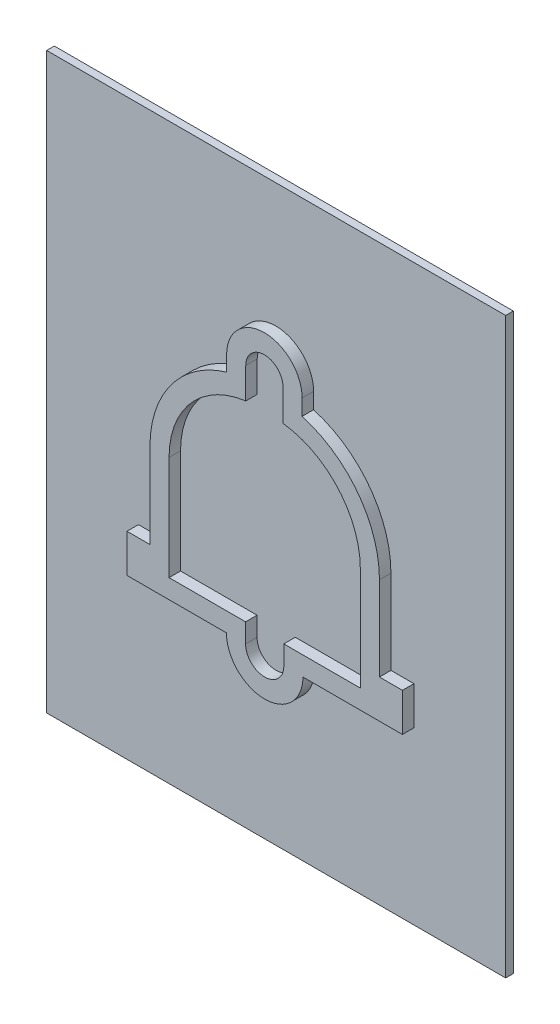
from build123d import *

# Parameters (mm, degrees)
EXTRUSION3_DEPTH = 0.3
ESQUISSE2_W      = 12
ESQUISSE2_H      = 15
EXTRUSION4_DEPTH = 0.2


with BuildPart() as part:
    # Esquisse1 → Extrusion3 (new body)
    with BuildSketch(Plane.XY):
        with BuildLine():
            Line((-12.832841813, 25.021420219), (-12.832841813, 25.437540043))
            ThreePointArc((-12.832841813, 25.437540043), (-13.819409399, 26.424107629), (-14.805976985, 25.437540043))
            Line((-14.805976985, 25.437540043), (-14.805976985, 25.037540043))
            ThreePointArc((-14.805976985, 25.037540043), (-15.667751578, 24.60975507), (-16.333846188, 23.915512028))
            ThreePointArc((-16.333846188, 23.915512028), (-16.688617291, 23.169755053), (-16.810405862, 22.352942012))
            Line((-16.810405862, 22.352942012), (-16.810405862, 20.131551422))
            Line((-16.810405862, 20.131551422), (-17.410405862, 20.131551422))
            Line((-17.410405862, 20.131551422), (-17.410405862, 19.131551422))
            Line((-17.410405862, 19.131551422), (-14.810405862, 19.131551422))
            ThreePointArc((-14.810405862, 19.131551422), (-13.810405862, 18.131551422), (-12.810405862, 19.131551422))
            Line((-12.810405862, 19.131551422), (-10.210405862, 19.131551422))
            Line((-10.210405862, 19.131551422), (-10.210405862, 20.131551422))
            Line((-10.210405862, 20.131551422), (-10.810405862, 20.131551422))
            Line((-10.810405862, 20.131551422), (-10.810405862, 22.331551422))
            ThreePointArc((-10.810405862, 22.331551422), (-11.372418001, 24.014230931), (-12.832841813, 25.021420219))
        make_face()
        with BuildLine():
            Line((-11.310405862, 22.331551422), (-11.310405862, 19.631551422))
            Line((-11.310405862, 19.631551422), (-13.310405862, 19.631551422))
            Line((-13.310405862, 19.631551422), (-13.310405862, 19.131551422))
            ThreePointArc((-13.310405862, 19.131551422), (-13.810405862, 18.631551422), (-14.310405862, 19.131551422))
            Line((-14.310405862, 19.131551422), (-14.310405862, 19.631551422))
            Line((-14.310405862, 19.631551422), (-16.310405862, 19.631551422))
            Line((-16.310405862, 19.631551422), (-16.310405862, 22.352942012))
            ThreePointArc((-16.310405862, 22.352942012), (-16.21036525, 23.023895582), (-15.91894613, 23.636481668))
            ThreePointArc((-15.91894613, 23.636481668), (-15.220043493, 24.309156929), (-14.305976985, 24.633871146))
            Line((-14.305976985, 24.633871146), (-14.305976985, 25.437540043))
            ThreePointArc((-14.305976985, 25.437540043), (-13.819409399, 25.924107629), (-13.332841813, 25.437540043))
            Line((-13.332841813, 25.437540043), (-13.332841813, 24.614741777))
            ThreePointArc((-13.332841813, 24.614741777), (-11.888721032, 23.856609238), (-11.310405862, 22.331551422))
        make_face(mode=Mode.SUBTRACT)
    extrude(amount=EXTRUSION3_DEPTH)

    # Esquisse2 → Extrusion4 (add)
    with BuildSketch(Plane(origin=(0, 0, 0), x_dir=(-1, 0, 0), z_dir=(0, 0, -1))):
        with Locations((13.810405862, 22.167730135)):
            Rectangle(ESQUISSE2_W, ESQUISSE2_H)
    extrude(amount=EXTRUSION4_DEPTH)


solid = part.part
